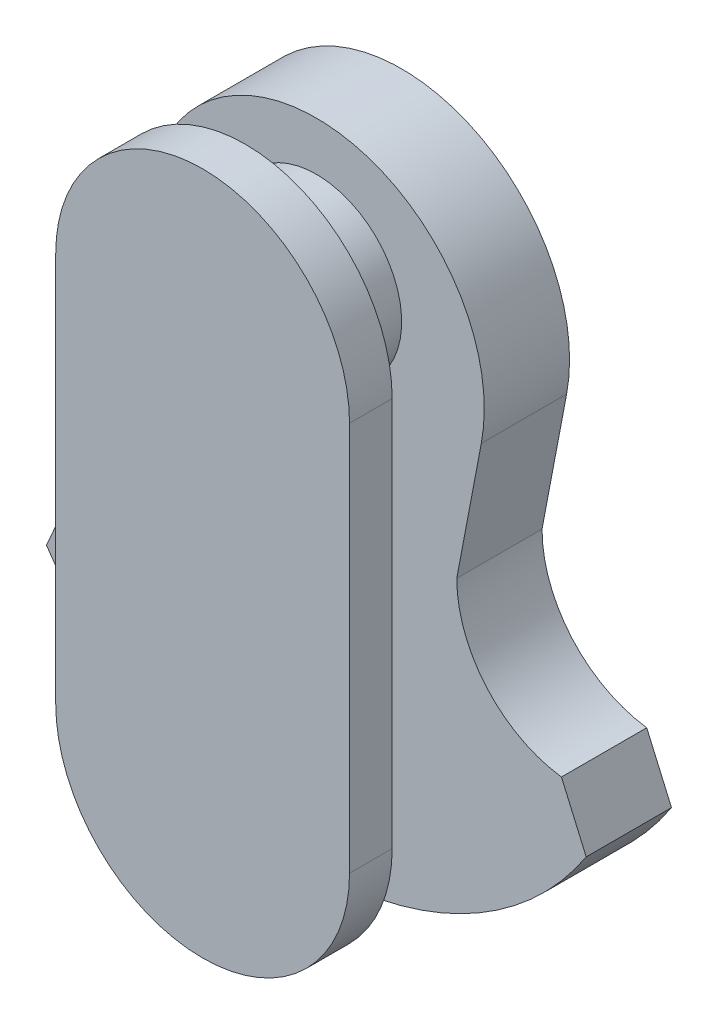
from build123d import *

# Parameters (mm, degrees)
EXTRUDE_1_DEPTH = 18
SKETCH_2_R      = 18
EXTRUDE_2_DEPTH = 15
EXTRUDE_3_DEPTH = 9


with BuildPart() as part:
    # Эскиз1 → Бобышка-Вытянуть1 (new body)
    with BuildSketch(Plane.XY):
        with BuildLine():
            Line((513.746536265, 159.110381716), (518.975806012, 171.093022728))
            ThreePointArc((518.975806012, 171.093022728), (534.766582533, 179.569802198), (541.069644925, 196.347043265))
            Line((541.069644925, 196.347043265), (535.885484235, 223.616162023))
            ThreePointArc((535.885484235, 223.616162023), (570.695429585, 265.667333265), (605.505374934, 223.616162023))
            Line((605.505374934, 223.616162023), (600.321214244, 196.347043265))
            ThreePointArc((600.321214244, 196.347043265), (606.624276637, 179.569802198), (622.415053158, 171.093022728))
            Line((622.415053158, 171.093022728), (627.644322904, 159.110381716))
            ThreePointArc((627.644322904, 159.110381716), (570.695429585, 128.269815911), (513.746536265, 159.110381716))
        make_face()
    extrude(amount=EXTRUDE_1_DEPTH)


with BuildPart() as body_2:
    # Эскиз2 → Бобышка-Вытянуть2 (new body)
    with BuildSketch(Plane.XY.offset(18)):
        with Locations((570.695429585, 237.392875312)):
            Circle(SKETCH_2_R)
    extrude(amount=EXTRUDE_2_DEPTH)


with BuildPart() as body_3:
    # Эскиз4 → Бобышка-Вытянуть3 (new body)
    with BuildSketch(Plane.XY.offset(33)):
        with BuildLine():
            Line((539.695429585, 155.14675651), (539.695429585, 237.392875312))
            ThreePointArc((539.695429585, 237.392875312), (570.695429585, 268.392875312), (601.695429585, 237.392875312))
            Line((601.695429585, 237.392875312), (601.695429585, 155.14675651))
            ThreePointArc((601.695429585, 155.14675651), (570.695429585, 124.14675651), (539.695429585, 155.14675651))
        make_face()
    extrude(amount=EXTRUDE_3_DEPTH)

    # Combine 3: union part, body 2
    add(part.part)
    add(body_2.part)


solid = body_3.part
